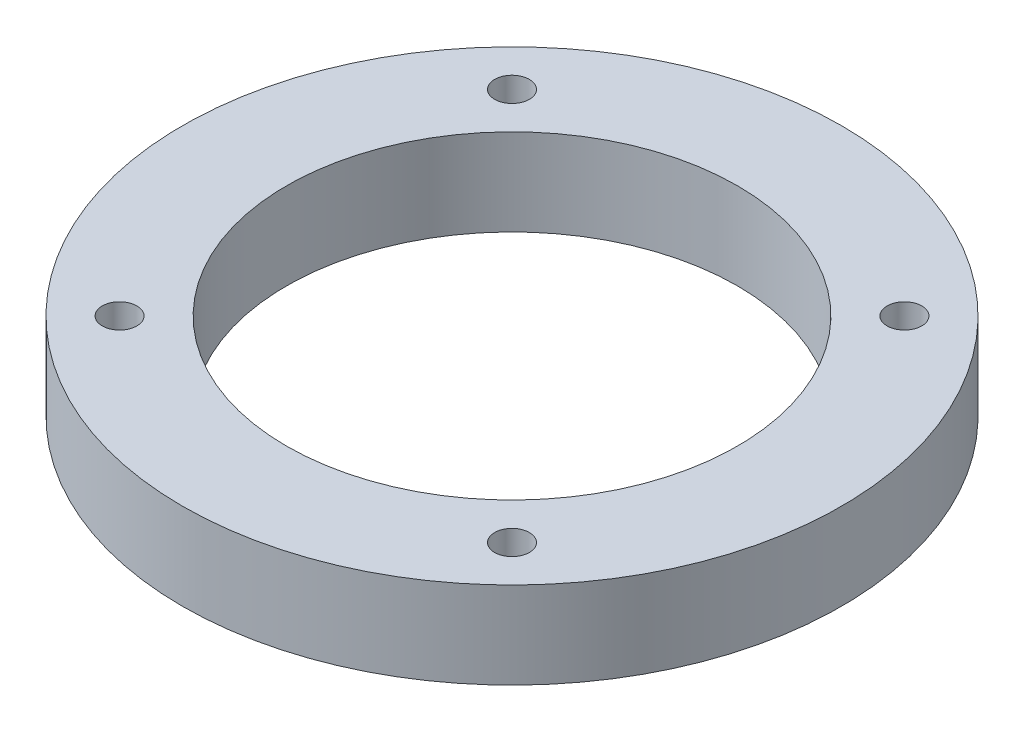
from build123d import *

# Parameters (mm, degrees)
SKETCH1_R           = 38
SKETCH1_R_2         = 26
SKETCH1_R_3         = 2
BOSS_EXTRUDE1_DEPTH = 10


with BuildPart() as part:
    # Sketch1 → Boss-Extrude1 (new body)
    with BuildSketch(Plane(origin=(0, 0, 0), x_dir=(1, 0, 0), z_dir=(0, 1, 0))):
        with Locations(Location((0, 0, 0), (0, 0, 270))):
            Circle(SKETCH1_R)
        with Locations(Location((0, 0, 0), (0, 0, 270))):
            Circle(SKETCH1_R_2, mode=Mode.SUBTRACT)
        with Locations(Location((-22.625, 22.625, 0), (0, 0, 270))):
            Circle(SKETCH1_R_3, mode=Mode.SUBTRACT)
        with Locations(Location((22.625, 22.625, 0), (0, 0, 270))):
            Circle(SKETCH1_R_3, mode=Mode.SUBTRACT)
        with Locations(Location((22.625, -22.625, 0), (0, 0, 270))):
            Circle(SKETCH1_R_3, mode=Mode.SUBTRACT)
        with Locations(Location((-22.625, -22.625, 0), (0, 0, 270))):
            Circle(SKETCH1_R_3, mode=Mode.SUBTRACT)
    extrude(amount=BOSS_EXTRUDE1_DEPTH)


solid = part.part
